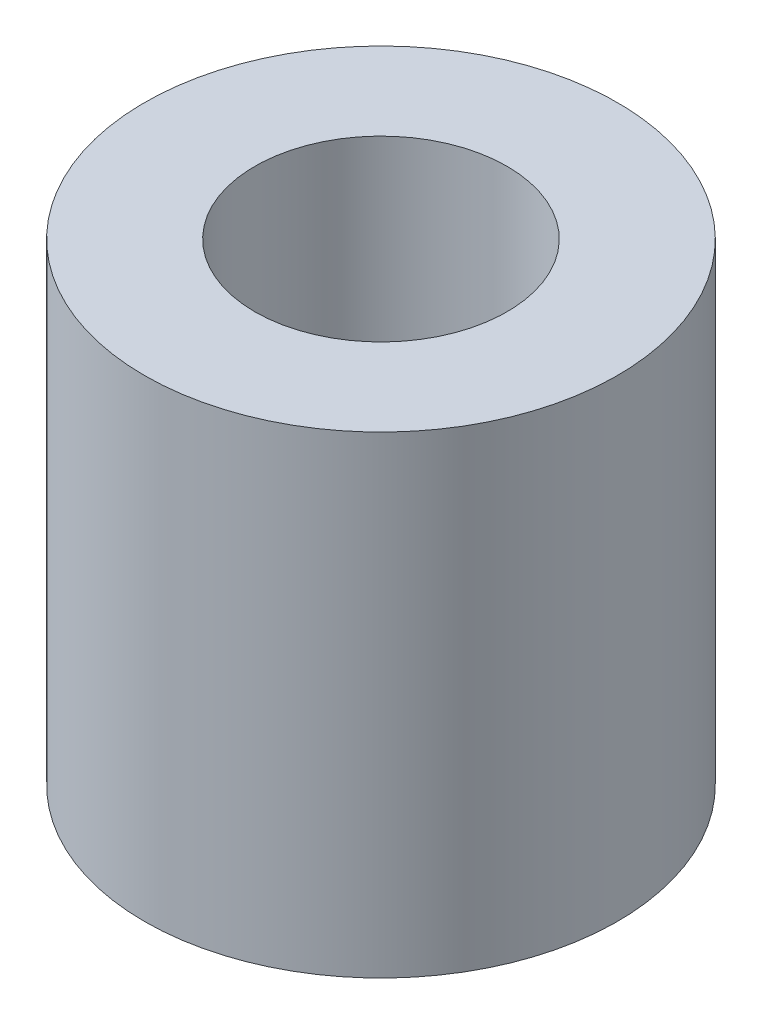
from build123d import *

# Parameters (mm, degrees)
SKETCH_1_R      = 3
SKETCH_1_R_2    = 1.6
EXTRUDE_1_DEPTH = 6


with BuildPart() as part:
    # ｽｹｯﾁ1 → ﾎﾞｽ - 押し出し1 (new body)
    with BuildSketch(Plane(origin=(0, 0, 0), x_dir=(1, 0, 0), z_dir=(0, 1, 0))):
        with Locations(Location((0, 0, 0), (0, 0, 270))):
            Circle(SKETCH_1_R)
        with Locations(Location((0, 0, 0), (0, 0, 270))):
            Circle(SKETCH_1_R_2, mode=Mode.SUBTRACT)
    extrude(amount=EXTRUDE_1_DEPTH)


solid = part.part
